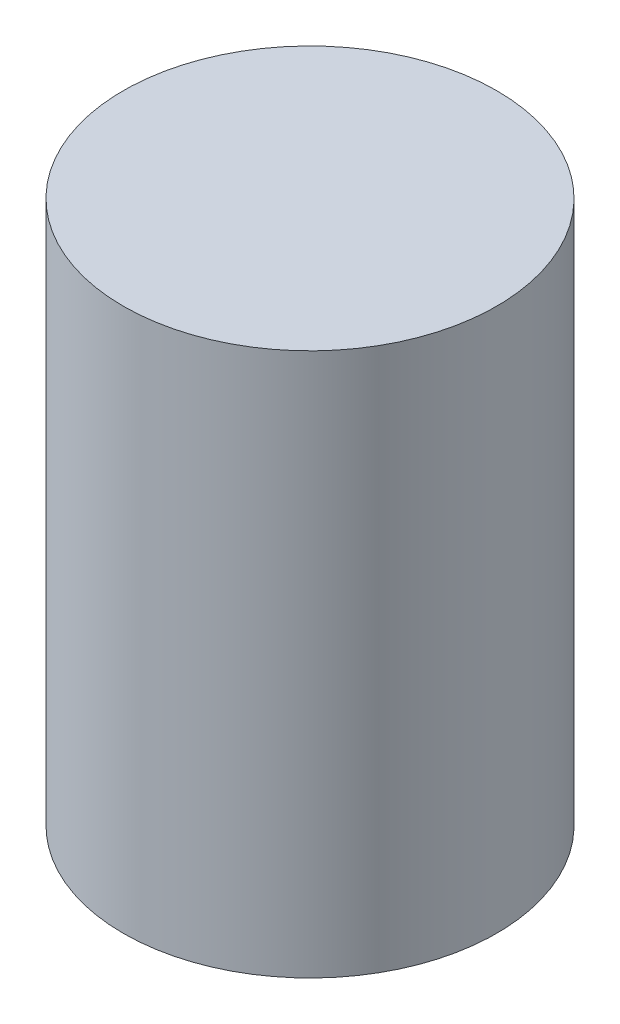
from build123d import *

# Parameters (mm, degrees)
SKETCH1_R           = 2.75
BOSS_EXTRUDE1_DEPTH = 4


with BuildPart() as part:
    # Sketch1 → Boss-Extrude1 (new, symmetric)
    with BuildSketch(Plane(origin=(0, 0, 0), x_dir=(1, 0, 0), z_dir=(0, 1, 0))):
        with Locations(Location((0, 0, 0), (0, 0, 270))):
            Circle(SKETCH1_R)
    extrude(amount=BOSS_EXTRUDE1_DEPTH, both=True)


solid = part.part
